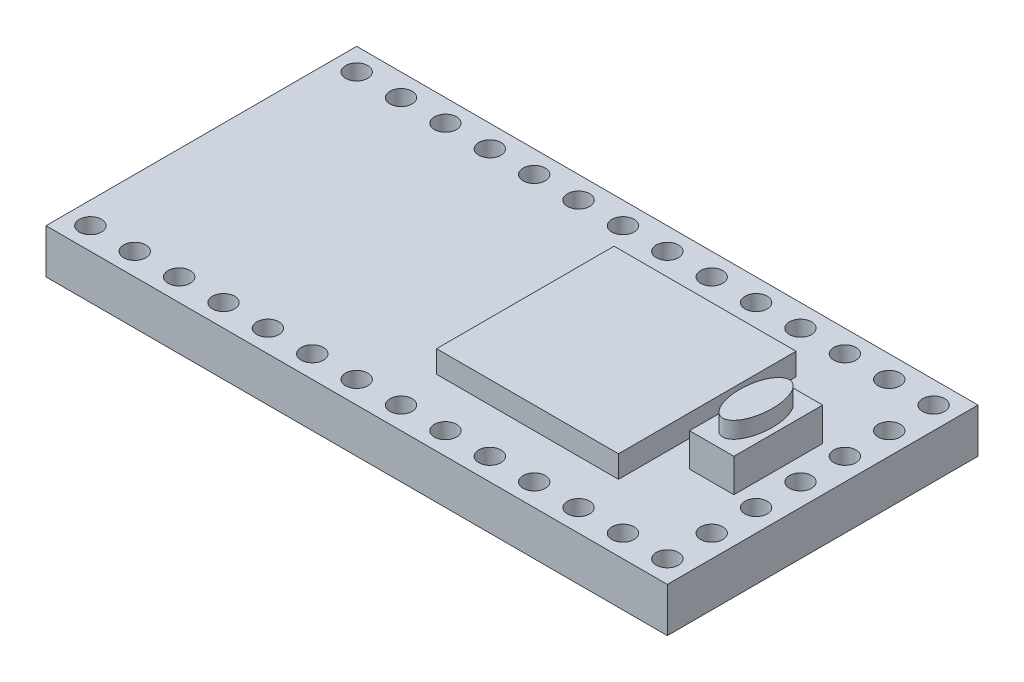
from build123d import *

# Parameters (mm, degrees)
SKETCH1_W           = 35.56
SKETCH1_H           = 17.78
BOSS_EXTRUDE1_DEPTH = 2.54
SKETCH2_R           = 0.635
CUT_EXTRUDE1_DEPTH  = 2.54
SKETCH3_W           = 2.54
SKETCH3_H           = 5.08
BOSS_EXTRUDE2_DEPTH = 1.905
SKETCH4_RX          = 1.905
SKETCH4_RY          = 0.9398
BOSS_EXTRUDE3_DEPTH = 0.9398
SKETCH5_W           = 10.414444886
SKETCH5_H           = 10.16
BOSS_EXTRUDE4_DEPTH = 1.27


with BuildPart() as part:
    # Sketch1 → Boss-Extrude1 (new body)
    with BuildSketch(Plane(origin=(0, 0, 0), x_dir=(1, 0, 0), z_dir=(0, 1, 0))):
        Rectangle(SKETCH1_W, SKETCH1_H)
    extrude(amount=BOSS_EXTRUDE1_DEPTH)

    # Sketch2 → Cut-Extrude1 (cut)
    with BuildSketch(Plane(origin=(0, 2.54, 0), x_dir=(1, 0, 0), z_dir=(0, 1, 0))):
        with Locations(Location((-16.51, 7.62, 0), (0, 0, 270))):
            Circle(SKETCH2_R)
        with Locations(Location((-16.51, -7.62, 0), (0, 0, 270))):
            Circle(SKETCH2_R)
        with Locations(Location((-13.97, 7.62, 0), (0, 0, 270))):
            Circle(SKETCH2_R)
        with Locations(Location((-13.97, -7.62, 0), (0, 0, 270))):
            Circle(SKETCH2_R)
        with Locations(Location((-11.43, 7.62, 0), (0, 0, 270))):
            Circle(SKETCH2_R)
        with Locations(Location((-11.43, -7.62, 0), (0, 0, 270))):
            Circle(SKETCH2_R)
        with Locations(Location((-8.89, 7.62, 0), (0, 0, 270))):
            Circle(SKETCH2_R)
        with Locations(Location((-8.89, -7.62, 0), (0, 0, 270))):
            Circle(SKETCH2_R)
        with Locations(Location((-6.35, 7.62, 0), (0, 0, 270))):
            Circle(SKETCH2_R)
        with Locations(Location((-6.35, -7.62, 0), (0, 0, 270))):
            Circle(SKETCH2_R)
        with Locations(Location((-3.81, 7.62, 0), (0, 0, 270))):
            Circle(SKETCH2_R)
        with Locations(Location((-3.81, -7.62, 0), (0, 0, 270))):
            Circle(SKETCH2_R)
        with Locations(Location((-1.27, 7.62, 0), (0, 0, 270))):
            Circle(SKETCH2_R)
        with Locations(Location((-1.27, -7.62, 0), (0, 0, 270))):
            Circle(SKETCH2_R)
        with Locations(Location((1.27, 7.62, 0), (0, 0, 270))):
            Circle(SKETCH2_R)
        with Locations(Location((1.27, -7.62, 0), (0, 0, 270))):
            Circle(SKETCH2_R)
        with Locations(Location((3.81, 7.62, 0), (0, 0, 270))):
            Circle(SKETCH2_R)
        with Locations(Location((3.81, -7.62, 0), (0, 0, 270))):
            Circle(SKETCH2_R)
        with Locations(Location((6.35, 7.62, 0), (0, 0, 270))):
            Circle(SKETCH2_R)
        with Locations(Location((6.35, -7.62, 0), (0, 0, 270))):
            Circle(SKETCH2_R)
        with Locations(Location((8.89, 7.62, 0), (0, 0, 270))):
            Circle(SKETCH2_R)
        with Locations(Location((8.89, -7.62, 0), (0, 0, 270))):
            Circle(SKETCH2_R)
        with Locations(Location((11.43, 7.62, 0), (0, 0, 270))):
            Circle(SKETCH2_R)
        with Locations(Location((11.43, -7.62, 0), (0, 0, 270))):
            Circle(SKETCH2_R)
        with Locations(Location((13.97, 7.62, 0), (0, 0, 270))):
            Circle(SKETCH2_R)
        with Locations(Location((13.97, -7.62, 0), (0, 0, 270))):
            Circle(SKETCH2_R)
        with Locations(Location((16.51, 7.62, 0), (0, 0, 270))):
            Circle(SKETCH2_R)
        with Locations(Location((16.51, -7.62, 0), (0, 0, 270))):
            Circle(SKETCH2_R)
        with Locations(Location((16.51, 5.08, 0), (0, 0, 270))):
            Circle(SKETCH2_R)
        with Locations(Location((16.51, 2.54, 0), (0, 0, 270))):
            Circle(SKETCH2_R)
        with Locations(Location((16.51, 0, 0), (0, 0, 270))):
            Circle(SKETCH2_R)
        with Locations(Location((16.51, -2.54, 0), (0, 0, 270))):
            Circle(SKETCH2_R)
        with Locations(Location((16.51, -5.08, 0), (0, 0, 270))):
            Circle(SKETCH2_R)
    extrude(amount=-CUT_EXTRUDE1_DEPTH, mode=Mode.SUBTRACT)

    # Sketch3 → Boss-Extrude2 (add)
    with BuildSketch(Plane(origin=(0, 2.54, 0), x_dir=(1, 0, 0), z_dir=(0, 1, 0))):
        with Locations((13.97, 0)):
            Rectangle(SKETCH3_W, SKETCH3_H)
    extrude(amount=BOSS_EXTRUDE2_DEPTH)

    # Sketch4 → Boss-Extrude3 (add)
    with BuildSketch(Plane(origin=(0, 4.445, 0), x_dir=(1, 0, 0), z_dir=(0, 1, 0))):
        with Locations(Location((13.97, 0), (0, 0, -90))):
            Ellipse(SKETCH4_RX, SKETCH4_RY)
    extrude(amount=BOSS_EXTRUDE3_DEPTH)

    # Sketch5 → Boss-Extrude4 (add)
    with BuildSketch(Plane(origin=(0, 2.54, 0), x_dir=(1, 0, 0), z_dir=(0, 1, 0))):
        with Locations((5.968777557, 0)):
            Rectangle(SKETCH5_W, SKETCH5_H)
    extrude(amount=BOSS_EXTRUDE4_DEPTH)


solid = part.part
